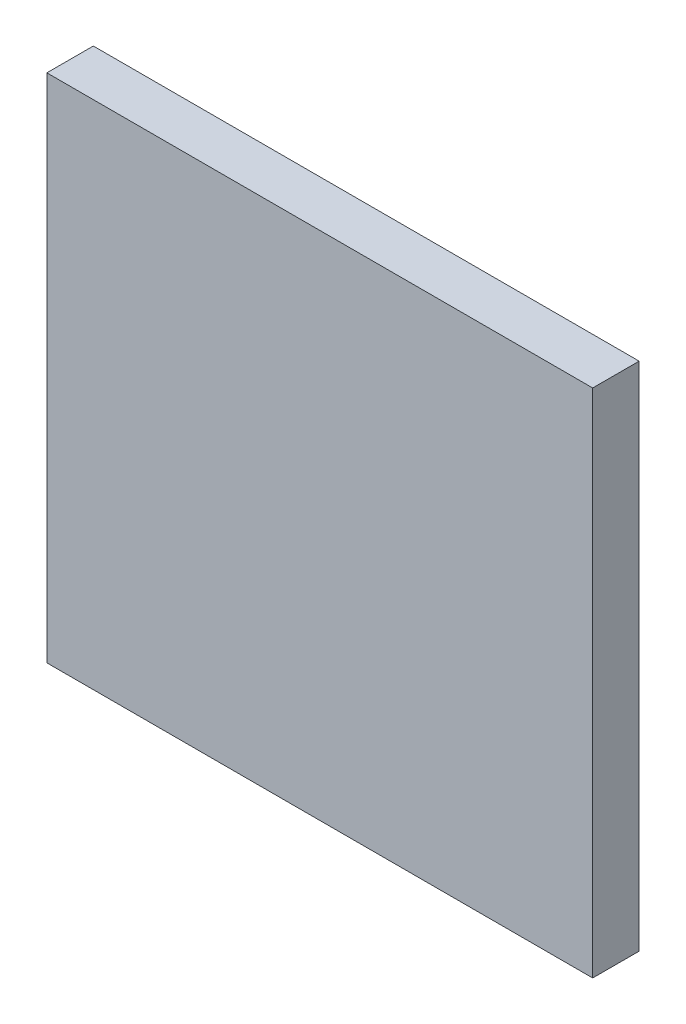
from build123d import *

# Parameters (mm, degrees)
ESQUISSE1_W        = 47
ESQUISSE1_H        = 44
BOSS_EXTRU_1_DEPTH = 4


with BuildPart() as part:
    # Esquisse1 → Boss.-Extru.1 (new body)
    with BuildSketch(Plane.XY):
        Rectangle(ESQUISSE1_W, ESQUISSE1_H)
    extrude(amount=BOSS_EXTRU_1_DEPTH)


solid = part.part
